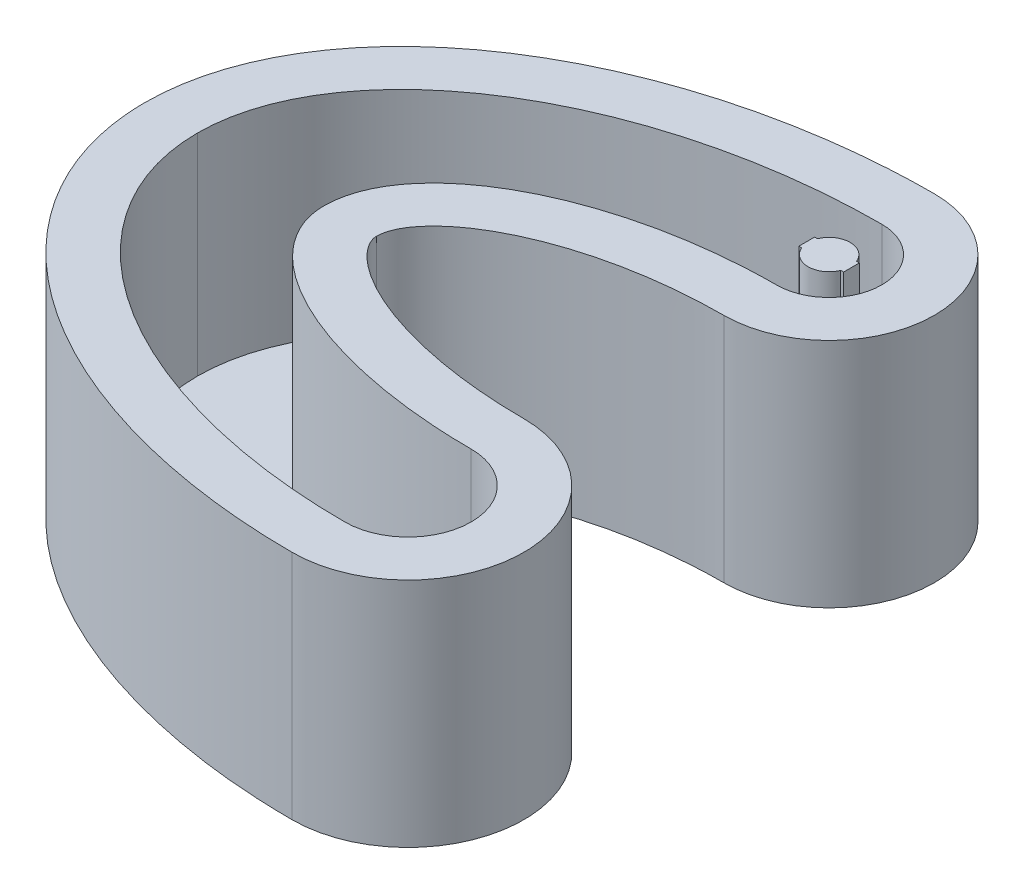
from build123d import *

# Parameters (mm, degrees)
SKETCH1_W           = 4.25
SKETCH1_H           = 1.5
SKETCH1_R           = 2
BOSS_EXTRUDE1_DEPTH = 20
FILLET1_R           = 20
CUT_EXTRUDE4_DEPTH  = 57.718365948
BOSS_EXTRUDE3_DEPTH = 2


with BuildPart() as part:
    # Sketch1 → Boss-Extrude1 (new body)
    # profile 1 of 3: a face of its own
    with BuildSketch(Plane(origin=(0, 0, 0), x_dir=(1, 0, 0), z_dir=(0, 1, 0))):
        with BuildLine():
            ThreePointArc((19, -35.199431814), (40, 0), (19, 35.199431814))
            add(Edge.make_bspline(
                [(19, 35.199431814), (-31, 35.199431814), (-31, 0), (-31, -35.199431814), (19, -35.199431814)],
                knots=[4.71238898, 4.71238898, 4.71238898, 6.283185307, 6.283185307, 7.853981634, 7.853981634, 7.853981634], degree=2, weights=[1, 0.707106781, 1, 0.707106781, 1]))
        make_face()
        with BuildLine():
            add(Edge.make_bspline(
                [(-20, 0), (-20, -25), (19, -25)],
                knots=[3.141592654, 3.141592654, 3.141592654, 4.71238898, 4.71238898, 4.71238898], degree=2, weights=[1, 0.707106781, 1]))
            ThreePointArc((19, -25), (25, -19), (19, -13))
            add(Edge.make_bspline(
                [(-8, 0), (-8, -13), (19, -13)],
                knots=[3.141592654, 3.141592654, 3.141592654, 4.71238898, 4.71238898, 4.71238898], degree=2, weights=[1, 0.707106781, 1]))
            add(Edge.make_bspline(
                [(20, 15), (-8, 15), (-8, 0)],
                knots=[4.71238898, 4.71238898, 4.71238898, 6.283185307, 6.283185307, 6.283185307], degree=2, weights=[1, 0.707106781, 1]))
            ThreePointArc((20, 15), (25, 20), (20, 25))
            add(Edge.make_bspline(
                [(20, 25), (-20, 25), (-20, 0)],
                knots=[4.71238898, 4.71238898, 4.71238898, 6.283185307, 6.283185307, 6.283185307], degree=2, weights=[1, 0.707106781, 1]))
        make_face(mode=Mode.SUBTRACT)
    # profile 2 of 3: a face of its own
    with BuildSketch(Plane(origin=(0, 0, 0), x_dir=(1, 0, 0), z_dir=(0, 1, 0))):
        with Locations((20, 20)):
            Rectangle(SKETCH1_W, SKETCH1_H)
    # profile 3 of 3: a face of its own
    with BuildSketch(Plane(origin=(0, 0, 0), x_dir=(1, 0, 0), z_dir=(0, 1, 0))):
        with Locations((20, 20)):
            Circle(SKETCH1_R)
    extrude(amount=BOSS_EXTRUDE1_DEPTH)

    # Fillet1
    fillet1_edges = [part.edges().sort_by_distance(p)[0] for p in [
        (19, 10, 35.199431814),
        (19, 10, -35.199431814),
    ]]
    fillet(fillet1_edges, radius=FILLET1_R)

    # Sketch7 → Cut-Extrude4 (cut, through all)
    with BuildSketch(Plane(origin=(0, 20, 0), x_dir=(1, 0, 0), z_dir=(0, 1, 0))):
        with BuildLine():
            ThreePointArc((26.715732964, -29.770280687), (40, 0), (26.715732964, 29.770280687))
            ThreePointArc((26.715732964, 29.770280687), (19.455130595, 33.933063336), (11.126819445, 34.760311515))
            add(Edge.make_bspline(
                [(11.126819445, 34.760311515), (-31, 30.031450822), (-31, 0), (-31, -30.031450822), (11.126819445, -34.760311515)],
                knots=[4.870510674, 4.870510674, 4.870510674, 6.283185307, 6.283185307, 7.695859941, 7.695859941, 7.695859941], degree=2, weights=[1, 0.760744245, 1, 0.760744245, 1]))
            ThreePointArc((11.126819445, -34.760311515), (19.455130595, -33.933063336), (26.715732964, -29.770280687))
        make_face()
        with BuildLine():
            ThreePointArc((19, -30), (30, -19), (19, -8))
            add(Edge.make_bspline(
                [(19, -8), (16.949769903, -8), (14.919635491, -7.878666683), (10.901282891, -7.382919134), (8.912757648, -7.010358838), (5.971139447, -6.202945035), (4.997539224, -5.89190988), (3.068908542, -5.157719425), (2.126517993, -4.74019977), (0.764362392, -4.004141758), (0.322031311, -3.741869686), (-0.532189619, -3.173382456), (-0.944387188, -2.867611504), (-1.723714217, -2.19101206), (-2.091329975, -1.822097486), (-2.556980251, -1.19837062), (-2.695757658, -0.981738824), (-2.860509133, -0.633755004), (-2.908158215, -0.513903902), (-2.97875361, -0.261094229), (-3, -0.131812819), (-3, 0)],
                knots=[0, 0, 0, 0, 0.25, 0.25, 0.5, 0.5, 0.625, 0.625, 0.75, 0.75, 0.8125, 0.8125, 0.875, 0.875, 0.9375, 0.9375, 0.96875, 0.96875, 0.984375, 0.984375, 1, 1, 1, 1], degree=3))
            add(Edge.make_bspline(
                [(-3, 0), (-3, 0.285031799), (-2.959631015, 0.562359659), (-2.814885588, 1.104800319), (-2.709748408, 1.371089121), (-2.461272148, 1.874181792), (-2.317184542, 2.114182824), (-1.99963354, 2.577098674), (-1.825175914, 2.800814346), (-1.276267896, 3.439596997), (-0.87480875, 3.82674963), (-0.024552048, 4.54947581), (0.42675507, 4.885852158), (1.821869936, 5.823760621), (2.798624207, 6.352463398), (4.813129372, 7.283675579), (5.852594172, 7.684922548), (7.977223824, 8.383518933), (9.048140791, 8.676054913), (11.203966236, 9.168802291), (12.288911447, 9.368771294), (15.562468477, 9.845143032), (17.769500187, 10), (20, 10)],
                knots=[0, 0, 0, 0, 0.03125, 0.03125, 0.0625, 0.0625, 0.09375, 0.09375, 0.125, 0.125, 0.1875, 0.1875, 0.25, 0.25, 0.375, 0.375, 0.5, 0.5, 0.625, 0.625, 0.75, 0.75, 1, 1, 1, 1], degree=3))
            ThreePointArc((20, 10), (30, 20), (20, 30))
            add(Edge.make_bspline(
                [(20, 30), (17.506885485, 30), (15.035786069, 29.865839689), (10.137169124, 29.331930469), (7.709631756, 28.932302453), (4.103591326, 28.117951262), (2.907486905, 27.810491003), (1.122878, 27.291116637), (0.529602547, 27.108276881), (-0.653605213, 26.722224199), (-1.244583727, 26.518618911), (-4.175085126, 25.452580827), (-6.441879772, 24.44880061), (-9.705268999, 22.677039858), (-10.77010477, 22.041792974), (-12.847558758, 20.669732591), (-13.863683808, 19.929559071), (-15.797123556, 18.361792453), (-16.718574276, 17.532042734), (-18.460001381, 15.769730163), (-19.280080654, 14.837271556), (-20.421371096, 13.348583223), (-20.787483847, 12.83616717), (-21.476917659, 11.794452355), (-21.801615407, 11.26350717), (-22.713235734, 9.639191125), (-23.238041794, 8.514519366), (-23.885889726, 6.757286776), (-24.079223508, 6.156963169), (-24.411208155, 4.947908362), (-24.550157367, 4.339294596), (-24.885234569, 2.501097336), (-25, 1.259219511), (-25, 0)],
                knots=[0, 0, 0, 0, 0.125, 0.125, 0.25, 0.25, 0.3125, 0.3125, 0.34375, 0.34375, 0.375, 0.375, 0.5, 0.5, 0.5625, 0.5625, 0.625, 0.625, 0.6875, 0.6875, 0.75, 0.75, 0.78125, 0.78125, 0.8125, 0.8125, 0.875, 0.875, 0.90625, 0.90625, 0.9375, 0.9375, 1, 1, 1, 1], degree=3))
            add(Edge.make_bspline(
                [(-25, 0), (-25, -1.240308905), (-24.890770056, -2.461968136), (-24.573162079, -4.268203825), (-24.441569921, -4.865890529), (-24.127593634, -6.052591833), (-23.944778823, -6.642798298), (-23.323001596, -8.392705426), (-22.818651301, -9.511975262), (-21.942628691, -11.127913821), (-21.630615899, -11.656018714), (-20.968244179, -12.692022913), (-20.616907359, -13.201217603), (-19.5140031, -14.690401179), (-18.720794555, -15.623701529), (-17.035314836, -17.388590032), (-16.14294207, -18.220073874), (-14.737950827, -19.399090724), (-14.258510207, -19.780688978), (-13.27835672, -20.522044282), (-12.776381285, -20.882617535), (-11.253117844, -21.923790649), (-10.212610594, -22.565910833), (-7.025562968, -24.355980763), (-4.814122151, -25.368940752), (-1.387363071, -26.660422544), (-0.225164261, -27.05297986), (2.128195088, -27.762814909), (3.310723323, -28.077620201), (6.874523869, -28.910820054), (9.271893934, -29.318808502), (14.106192667, -29.86347351), (16.543143218, -30), (19, -30)],
                knots=[0, 0, 0, 0, 0.0625, 0.0625, 0.09375, 0.09375, 0.125, 0.125, 0.1875, 0.1875, 0.21875, 0.21875, 0.25, 0.25, 0.3125, 0.3125, 0.375, 0.375, 0.40625, 0.40625, 0.4375, 0.4375, 0.5, 0.5, 0.625, 0.625, 0.6875, 0.6875, 0.75, 0.75, 0.875, 0.875, 1, 1, 1, 1], degree=3))
        make_face(mode=Mode.SUBTRACT)
    extrude(amount=-CUT_EXTRUDE4_DEPTH, mode=Mode.SUBTRACT)

    # Sketch8 → Boss-Extrude3 (add)
    with BuildSketch(Plane(origin=(0, 0, 0), x_dir=(1, 0, 0), z_dir=(0, 1, 0))):
        with BuildLine():
            ThreePointArc((19, -30), (30, -19), (19, -8))
            add(Edge.make_bspline(
                [(19, -8), (16.949769903, -8), (14.919635491, -7.878666683), (10.901282891, -7.382919134), (8.912757648, -7.010358838), (5.971139447, -6.202945035), (4.997539224, -5.89190988), (3.068908542, -5.157719425), (2.126517993, -4.74019977), (0.764362392, -4.004141758), (0.322031311, -3.741869686), (-0.532189619, -3.173382456), (-0.944387188, -2.867611504), (-1.723714217, -2.19101206), (-2.091329975, -1.822097486), (-2.556980251, -1.19837062), (-2.695757658, -0.981738824), (-2.860509133, -0.633755004), (-2.908158215, -0.513903902), (-2.97875361, -0.261094229), (-3, -0.131812819), (-3, 0)],
                knots=[0, 0, 0, 0, 0.25, 0.25, 0.5, 0.5, 0.625, 0.625, 0.75, 0.75, 0.8125, 0.8125, 0.875, 0.875, 0.9375, 0.9375, 0.96875, 0.96875, 0.984375, 0.984375, 1, 1, 1, 1], degree=3))
            add(Edge.make_bspline(
                [(-3, 0), (-3, 0.285031799), (-2.959631015, 0.562359659), (-2.814885588, 1.104800319), (-2.709748408, 1.371089121), (-2.461272148, 1.874181792), (-2.317184542, 2.114182824), (-1.99963354, 2.577098674), (-1.825175914, 2.800814346), (-1.276267896, 3.439596997), (-0.87480875, 3.82674963), (-0.024552048, 4.54947581), (0.42675507, 4.885852158), (1.821869936, 5.823760621), (2.798624207, 6.352463398), (4.813129372, 7.283675579), (5.852594172, 7.684922548), (7.977223824, 8.383518933), (9.048140791, 8.676054913), (11.203966236, 9.168802291), (12.288911447, 9.368771294), (15.562468477, 9.845143032), (17.769500187, 10), (20, 10)],
                knots=[0, 0, 0, 0, 0.03125, 0.03125, 0.0625, 0.0625, 0.09375, 0.09375, 0.125, 0.125, 0.1875, 0.1875, 0.25, 0.25, 0.375, 0.375, 0.5, 0.5, 0.625, 0.625, 0.75, 0.75, 1, 1, 1, 1], degree=3))
            ThreePointArc((20, 10), (30, 20), (20, 30))
            add(Edge.make_bspline(
                [(20, 30), (17.506885485, 30), (15.035786069, 29.865839689), (10.137169124, 29.331930469), (7.709631756, 28.932302453), (4.103591326, 28.117951262), (2.907486905, 27.810491003), (1.122878, 27.291116637), (0.529602547, 27.108276881), (-0.653605213, 26.722224199), (-1.244583727, 26.518618911), (-4.175085126, 25.452580827), (-6.441879772, 24.44880061), (-9.705268999, 22.677039858), (-10.77010477, 22.041792974), (-12.847558758, 20.669732591), (-13.863683808, 19.929559071), (-15.797123556, 18.361792453), (-16.718574276, 17.532042734), (-18.460001381, 15.769730163), (-19.280080654, 14.837271556), (-20.421371096, 13.348583223), (-20.787483847, 12.83616717), (-21.476917659, 11.794452355), (-21.801615407, 11.26350717), (-22.713235734, 9.639191125), (-23.238041794, 8.514519366), (-23.885889726, 6.757286776), (-24.079223508, 6.156963169), (-24.411208155, 4.947908362), (-24.550157367, 4.339294596), (-24.885234569, 2.501097336), (-25, 1.259219511), (-25, 0)],
                knots=[0, 0, 0, 0, 0.125, 0.125, 0.25, 0.25, 0.3125, 0.3125, 0.34375, 0.34375, 0.375, 0.375, 0.5, 0.5, 0.5625, 0.5625, 0.625, 0.625, 0.6875, 0.6875, 0.75, 0.75, 0.78125, 0.78125, 0.8125, 0.8125, 0.875, 0.875, 0.90625, 0.90625, 0.9375, 0.9375, 1, 1, 1, 1], degree=3))
            add(Edge.make_bspline(
                [(-25, 0), (-25, -1.240308905), (-24.890770056, -2.461968136), (-24.573162079, -4.268203825), (-24.441569921, -4.865890529), (-24.127593634, -6.052591833), (-23.944778823, -6.642798298), (-23.323001596, -8.392705426), (-22.818651301, -9.511975262), (-21.942628691, -11.127913821), (-21.630615899, -11.656018714), (-20.968244179, -12.692022913), (-20.616907359, -13.201217603), (-19.5140031, -14.690401179), (-18.720794555, -15.623701529), (-17.035314836, -17.388590032), (-16.14294207, -18.220073874), (-14.737950827, -19.399090724), (-14.258510207, -19.780688978), (-13.27835672, -20.522044282), (-12.776381285, -20.882617535), (-11.253117844, -21.923790649), (-10.212610594, -22.565910833), (-7.025562968, -24.355980763), (-4.814122151, -25.368940752), (-1.387363071, -26.660422544), (-0.225164261, -27.05297986), (2.128195088, -27.762814909), (3.310723323, -28.077620201), (6.874523869, -28.910820054), (9.271893934, -29.318808502), (14.106192667, -29.86347351), (16.543143218, -30), (19, -30)],
                knots=[0, 0, 0, 0, 0.0625, 0.0625, 0.09375, 0.09375, 0.125, 0.125, 0.1875, 0.1875, 0.21875, 0.21875, 0.25, 0.25, 0.3125, 0.3125, 0.375, 0.375, 0.40625, 0.40625, 0.4375, 0.4375, 0.5, 0.5, 0.625, 0.625, 0.6875, 0.6875, 0.75, 0.75, 0.875, 0.875, 1, 1, 1, 1], degree=3))
        make_face()
    extrude(amount=-BOSS_EXTRUDE3_DEPTH)


solid = part.part
